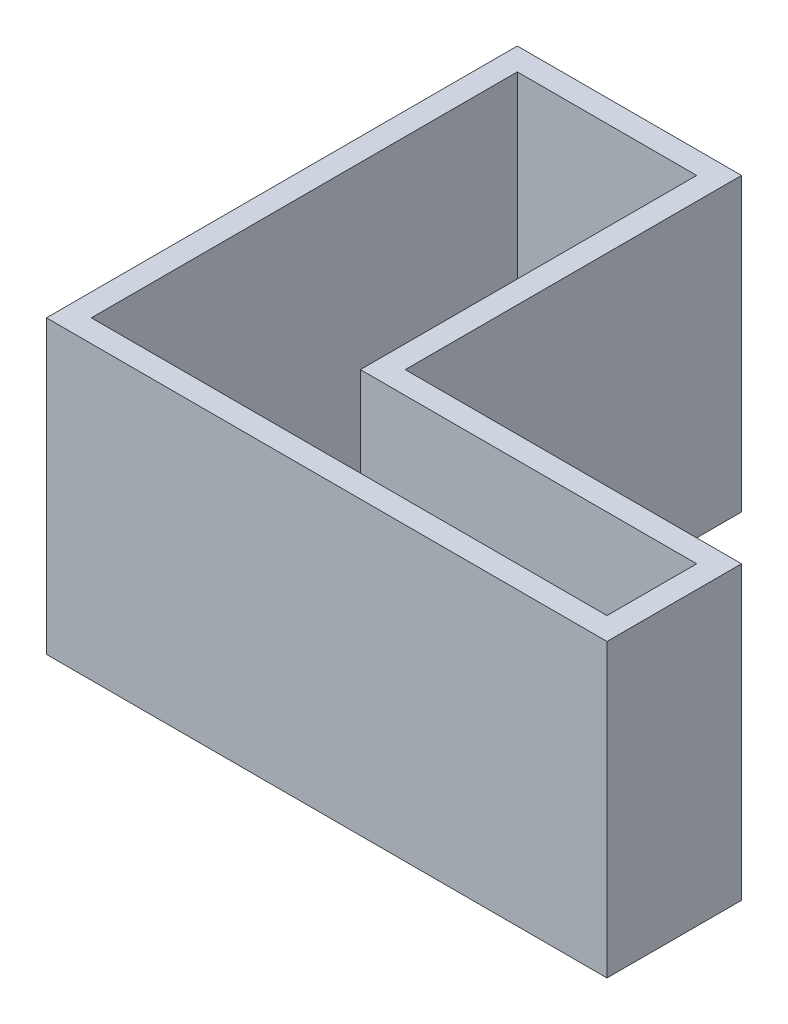
from build123d import *

# Parameters (mm, degrees)
EXTRUDE_1_DEPTH = 12
EXTRUDE_2_DEPTH = 1


with BuildPart() as part:
    # 草图1 → 凸台-拉伸1 (new body)
    with BuildSketch(Plane(origin=(0, 0, 0), x_dir=(1, 0, 0), z_dir=(0, 1, 0))):
        Polygon((0, 0), (0, 21), (10, 21), (10, 6), (25, 6), (25, 0), align=None)
        Polygon((1, 20), (9, 20), (9, 5), (24, 5), (24, 1), (1, 1), align=None, mode=Mode.SUBTRACT)
    extrude(amount=EXTRUDE_1_DEPTH)

    # 草图3 → 凸台-拉伸2 (add)
    with BuildSketch(Plane.XZ):
        Polygon((10, -21), (0, -21), (0, 0), (25, 0), (25, -6), (10, -6), align=None)
    extrude(amount=EXTRUDE_2_DEPTH)


solid = part.part
